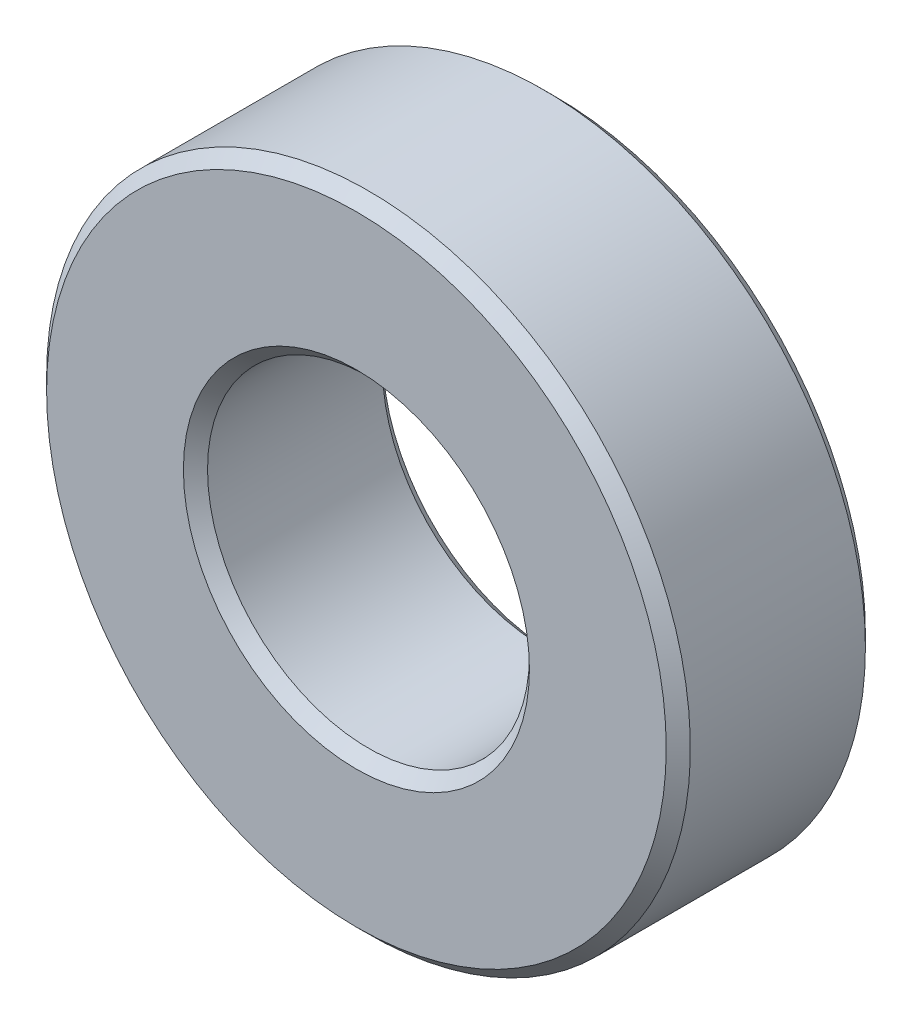
from build123d import *

# Parameters (mm, degrees)
SKETCH1_R           = 8
SKETCH1_R_2         = 4
BOSS_EXTRUDE1_DEPTH = 4.95
CHAMFER1_SIZE       = 0.3


with BuildPart() as part:
    # Sketch1 → Boss-Extrude1 (new body)
    with BuildSketch(Plane.XY):
        with Locations(Location((0, 0, 0), (0, 0, 180))):
            Circle(SKETCH1_R)
        with Locations(Location((0, 0, 0), (0, 0, 180))):
            Circle(SKETCH1_R_2, mode=Mode.SUBTRACT)
    extrude(amount=BOSS_EXTRUDE1_DEPTH)

    # Chamfer1
    chamfer1_edges = [part.edges().sort_by_distance(p)[0] for p in [
        (8, 0, 0),
        (8, 0, 4.95),
        (4, 0, 0),
        (4, 0, 4.95),
    ]]
    chamfer(chamfer1_edges, length=CHAMFER1_SIZE)


solid = part.part
